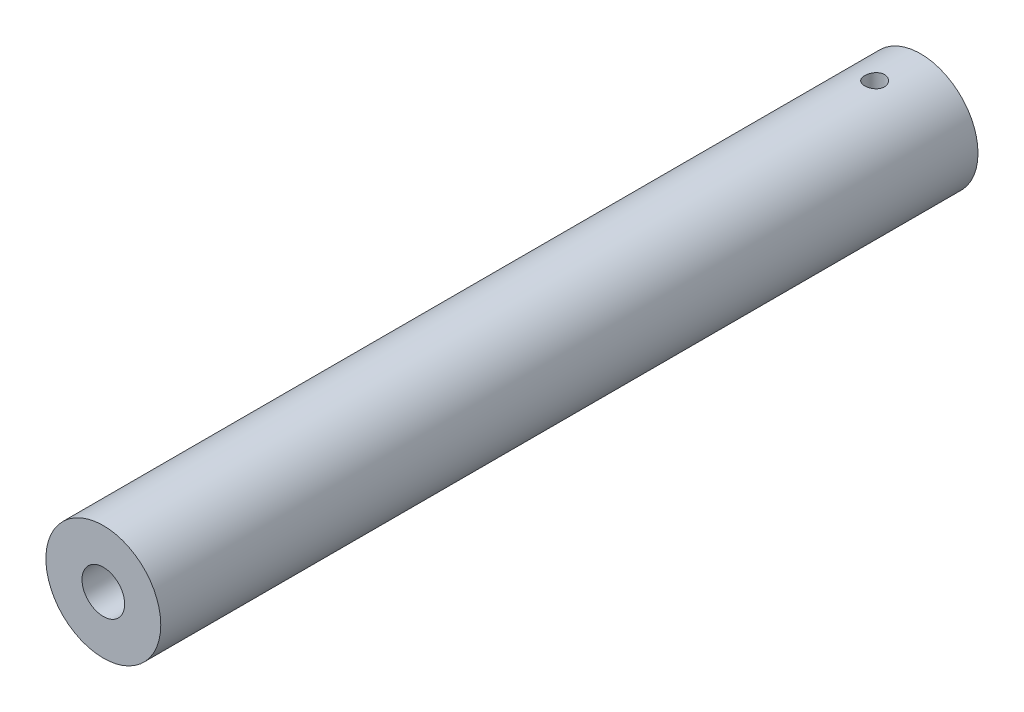
from build123d import *

# Parameters (mm, degrees)
SKETCH1_R               = 17.5
BOSS_EXTRUDE1_DEPTH     = 249
SKETCH2_R               = 6.5
CUT_EXTRUDE1_DEPTH      = 55
SKETCH9_R               = 10
CUT_EXTRUDE5_DEPTH      = 50
CUT_EXTRUDE6_DEPTH      = 251.226897035
CUT_EXTRUDE6_DEPTH_BACK = 251.226897035
SKETCH10_R              = 3


with BuildPart() as part:
    # Sketch1 → Boss-Extrude1 (new body)
    with BuildSketch(Plane.XY):
        Circle(SKETCH1_R)
    extrude(amount=BOSS_EXTRUDE1_DEPTH)

    # Sketch2 → Cut-Extrude1 (cut)
    with BuildSketch(Plane.XY.offset(249)):
        Circle(SKETCH2_R)
    extrude(amount=-CUT_EXTRUDE1_DEPTH, mode=Mode.SUBTRACT)

    # Sketch9 → Cut-Extrude5 (cut)
    with BuildSketch(Plane(origin=(0, 0, 0), x_dir=(-1, 0, 0), z_dir=(0, 0, -1))):
        Circle(SKETCH9_R)
    extrude(amount=-CUT_EXTRUDE5_DEPTH, mode=Mode.SUBTRACT)

    # Sketch10 → Cut-Extrude6 (cut, two sides: drawn at the far end of the back side and taken through both)
    with BuildSketch(Plane(origin=(0, 0, 0), x_dir=(1, 0, 0), z_dir=(0, 1, 0)).offset(-CUT_EXTRUDE6_DEPTH_BACK)):
        with Locations(Location((0, -14, 0), (0, 0, 270))):
            Circle(SKETCH10_R)
    extrude(amount=CUT_EXTRUDE6_DEPTH + CUT_EXTRUDE6_DEPTH_BACK, mode=Mode.SUBTRACT)


solid = part.part
